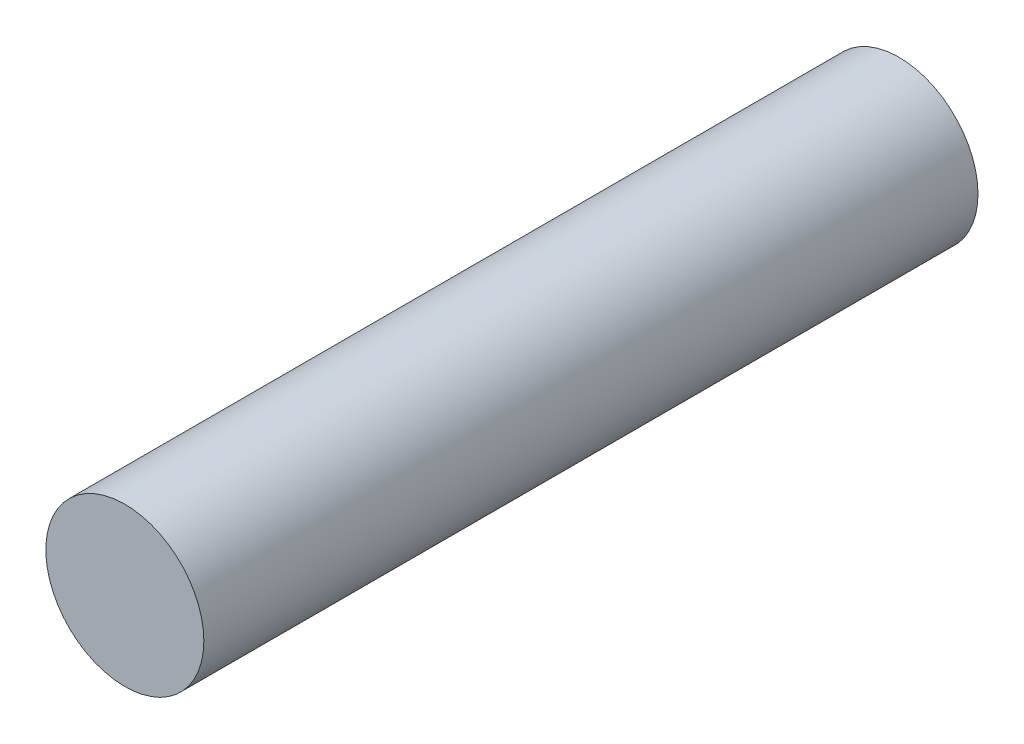
from build123d import *

# Parameters (mm, degrees)
SKETCH1_R           = 1
BOSS_EXTRUDE1_DEPTH = 9.8


with BuildPart() as part:
    # Sketch1 → Boss-Extrude1 (new body)
    with BuildSketch(Plane.XY):
        Circle(SKETCH1_R)
    extrude(amount=BOSS_EXTRUDE1_DEPTH)


solid = part.part
